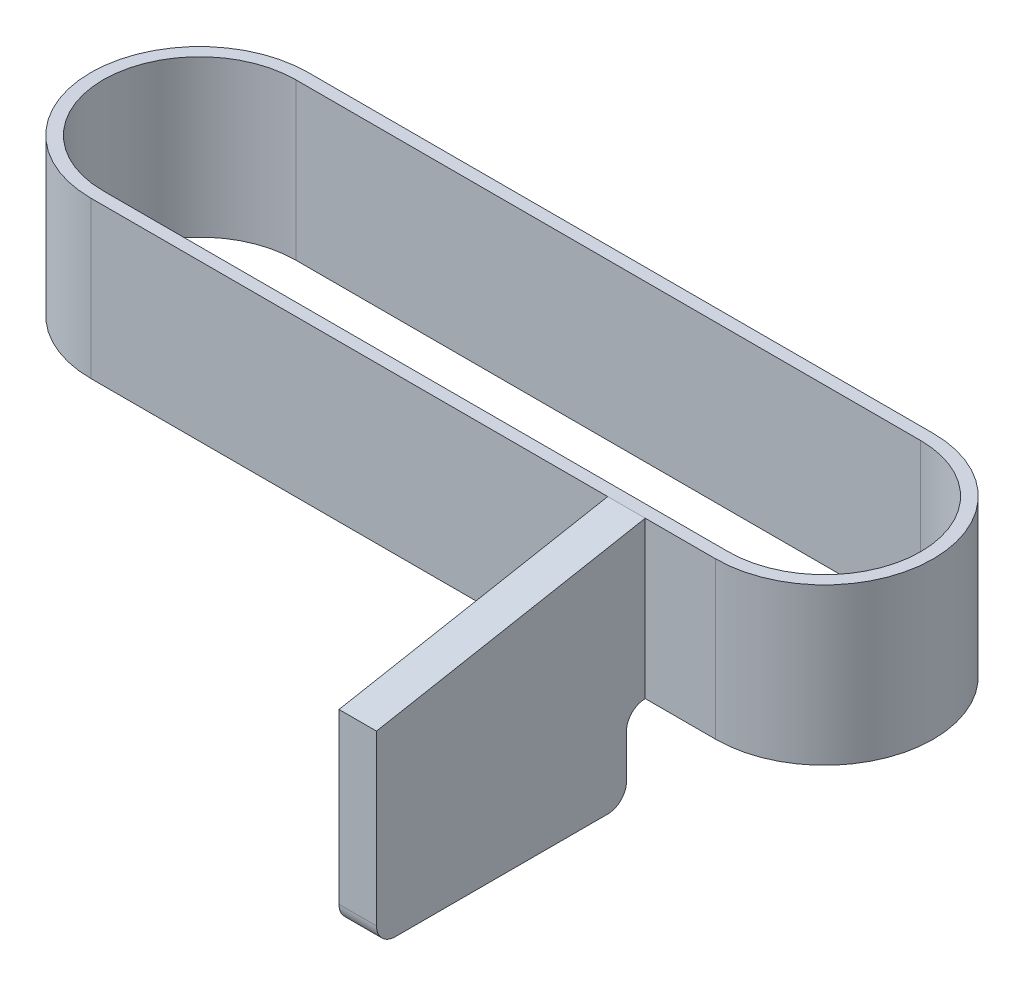
from build123d import *

# Parameters (mm, degrees)
EXTRUDE_1_DEPTH     = 12.5
SKETCH_4_W          = 6
SKETCH_4_H          = 43
EXTRUDE_3_DEPTH     = 38
SKETCH_5_W          = 6
SKETCH_5_H          = 13
CUT_EXTRUDE_2_DEPTH = 3
SKETCH_6_W          = 6
SKETCH_6_H          = 43
CUT_EXTRUDE_3_DEPTH = 8
EXTRUDE_5_DEPTH     = 6
FILLET_1_R          = 3
FILLET_2_R          = 3


with BuildPart() as part:
    # 草图1 → 凸台-拉伸1 (new, symmetric)
    with BuildSketch(Plane(origin=(0, 0, 0), x_dir=(1, 0, 0), z_dir=(0, 1, 0))):
        with BuildLine():
            Line((-50, 17.4), (50, 17.4))
            ThreePointArc((50, 17.4), (67.4, 0), (50, -17.4))
            Line((50, -17.4), (-50, -17.4))
            ThreePointArc((-50, -17.4), (-67.4, 0), (-50, 17.4))
        make_face()
        with BuildLine():
            Line((-50, 15.4), (50, 15.4))
            ThreePointArc((50, 15.4), (65.4, 0), (50, -15.4))
            Line((50, -15.4), (-50, -15.4))
            ThreePointArc((-50, -15.4), (-65.4, 0), (-50, 15.4))
        make_face(mode=Mode.SUBTRACT)
    extrude(amount=EXTRUDE_1_DEPTH, both=True)

    # 草图4 → 凸台-拉伸3 (add)
    with BuildSketch(Plane(origin=(0, 12.5, 0), x_dir=(1, 0, 0), z_dir=(0, 1, 0))):
        with Locations((35.717845516, -38.9)):
            Rectangle(SKETCH_4_W, SKETCH_4_H)
    extrude(amount=-EXTRUDE_3_DEPTH)

    # 草图5 → 切除-拉伸2 (cut)
    with BuildSketch(Plane(origin=(0, 0, 17.4), x_dir=(-1, 0, 0), z_dir=(0, 0, -1))):
        with Locations((-35.717845516, -19)):
            Rectangle(SKETCH_5_W, SKETCH_5_H)
    extrude(amount=-CUT_EXTRUDE_2_DEPTH, mode=Mode.SUBTRACT)

    # 草图6 → 切除-拉伸3 (cut)
    with BuildSketch(Plane(origin=(0, 12.5, 0), x_dir=(1, 0, 0), z_dir=(0, 1, 0))):
        with Locations((35.717845516, -38.9)):
            Rectangle(SKETCH_6_W, SKETCH_6_H)
    extrude(amount=-CUT_EXTRUDE_3_DEPTH, mode=Mode.SUBTRACT)

    # 草图8 → 凸台-拉伸5 (add)
    with BuildSketch(Plane.ZY.offset(-32.717845516)):
        Polygon((17.4, 12.5), (17.4, 4.5), (60.4, 4.5), align=None)
    extrude(amount=-EXTRUDE_5_DEPTH)

    # 圆角1
    fillet_1_edges = [part.edges().sort_by_distance(p)[0] for p in [
        (35.717845516, -25.5, 60.4),
        (35.717845516, -25.5, 20.4),
    ]]
    fillet(fillet_1_edges, radius=FILLET_1_R)

    # 圆角2
    fillet_2_edges = [part.edges().sort_by_distance(p)[0] for p in [
        (35.717845516, -12.5, 20.4),
    ]]
    fillet(fillet_2_edges, radius=FILLET_2_R)


solid = part.part
